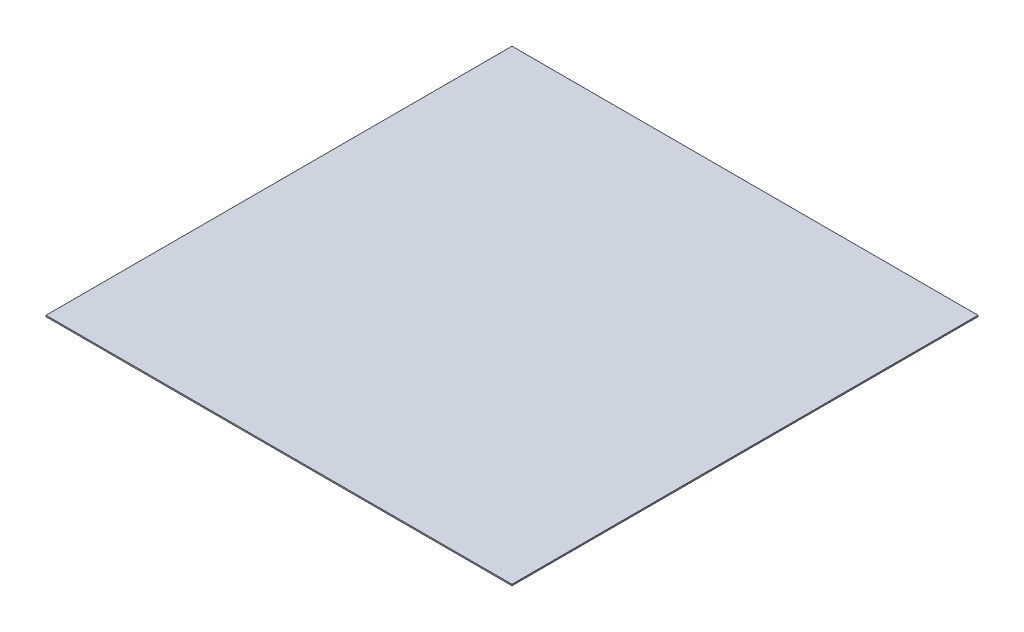
from build123d import *

# Parameters (mm, degrees)
SKETCH1_W           = 914.4
SKETCH1_H           = 914.4
BOSS_EXTRUDE1_DEPTH = 1.27


with BuildPart() as part:
    # Sketch1 → Boss-Extrude1 (new, symmetric)
    with BuildSketch(Plane(origin=(0, 0, 0), x_dir=(1, 0, 0), z_dir=(0, 1, 0))):
        Rectangle(SKETCH1_W, SKETCH1_H)
    extrude(amount=BOSS_EXTRUDE1_DEPTH, both=True)


solid = part.part
